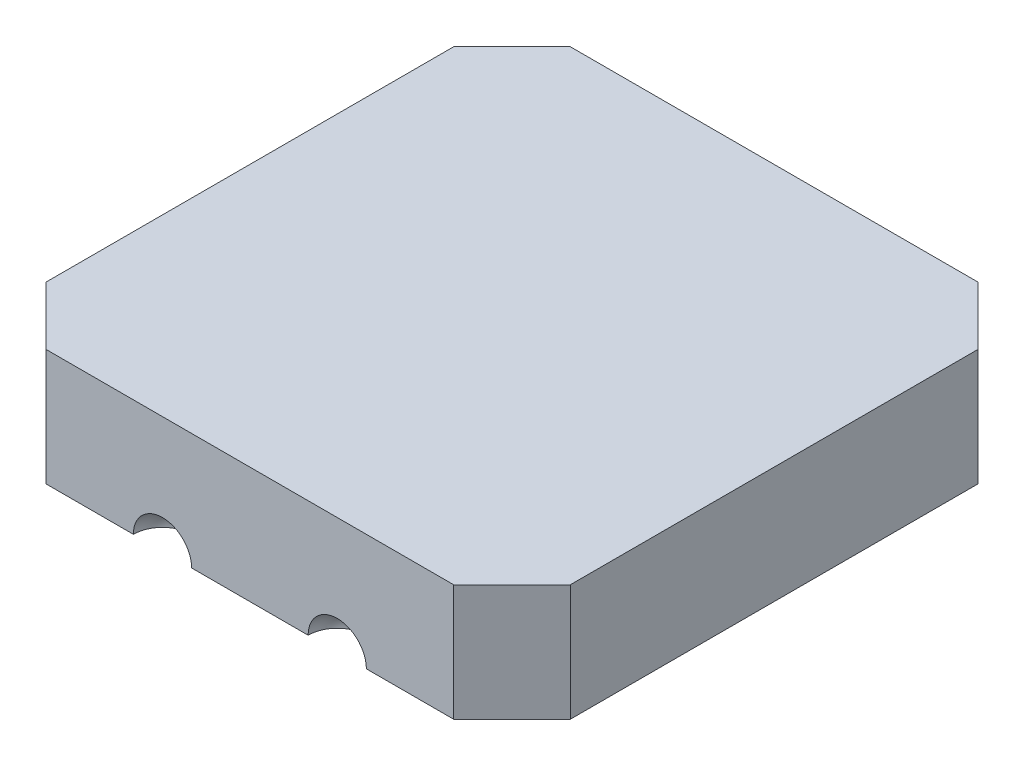
from build123d import *

# Parameters (mm, degrees)
SKETCH1_W           = 114.3
SKETCH1_H           = 114.3
BOSS_EXTRUDE1_DEPTH = 25.4
CHAMFER1_SIZE       = 12.7
SKETCH2_R           = 6.35
CUT_EXTRUDE1_DEPTH  = 5.08


with BuildPart() as part:
    # Sketch1 → Boss-Extrude1 (new body)
    with BuildSketch(Plane(origin=(0, 0, 0), x_dir=(1, 0, 0), z_dir=(0, 1, 0))):
        Rectangle(SKETCH1_W, SKETCH1_H)
    extrude(amount=BOSS_EXTRUDE1_DEPTH)

    # Chamfer1
    chamfer1_edges = [part.edges().sort_by_distance(p)[0] for p in [
        (57.15, 12.7, 57.15),
        (-57.15, 12.7, 57.15),
        (-57.15, 12.7, -57.15),
        (57.15, 12.7, -57.15),
    ]]
    chamfer(chamfer1_edges, length=CHAMFER1_SIZE)

    # Sketch2 → Cut-Extrude1 (cut)
    with BuildSketch(Plane(origin=(0, 0, 0), x_dir=(-1, 0, 0), z_dir=(0, -1, 0))):
        with Locations(Location((0, -47.625, 0), (0, 0, 90))):
            Circle(SKETCH2_R)
    extrude(amount=-CUT_EXTRUDE1_DEPTH, mode=Mode.SUBTRACT)

    # Sketch3 → Cut-Revolve4 (revolve, cut)
    with BuildSketch(Plane.XY.offset(57.15)):
        with BuildLine():
            Line((-25.4, 0), (-12.7, 0))
            ThreePointArc((-12.7, 0), (-19.05, 6.35), (-25.4, 0))
        make_face()
        with BuildLine():
            Line((25.4, 0), (12.7, 0))
            ThreePointArc((12.7, 0), (19.05, 6.35), (25.4, 0))
        make_face()
    revolve(axis=Axis((-57.15, 0, 57.15), (1, 0, 0)), mode=Mode.SUBTRACT)


solid = part.part
